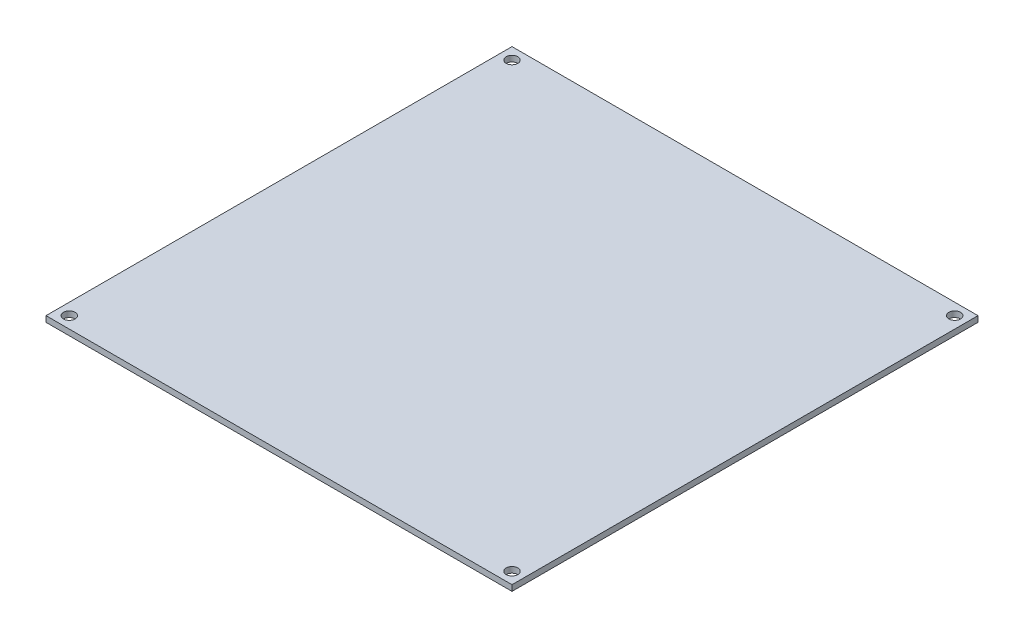
from build123d import *

# Parameters (mm, degrees)
SKETCH1_W           = 127
SKETCH1_H           = 127
SKETCH1_R           = 1.5875
BOSS_EXTRUDE1_DEPTH = 1.5875


with BuildPart() as part:
    # Sketch1 → Boss-Extrude1 (new body)
    with BuildSketch(Plane(origin=(0, 0, 0), x_dir=(1, 0, 0), z_dir=(0, 1, 0))):
        with Locations((63.5, 63.5)):
            Rectangle(SKETCH1_W, SKETCH1_H)
        with Locations(Location((3.175, 123.825, 0), (0, 0, 270))):
            Circle(SKETCH1_R, mode=Mode.SUBTRACT)
        with Locations(Location((123.825, 123.825, 0), (0, 0, 270))):
            Circle(SKETCH1_R, mode=Mode.SUBTRACT)
        with Locations(Location((123.825, 3.175, 0), (0, 0, 270))):
            Circle(SKETCH1_R, mode=Mode.SUBTRACT)
        with Locations(Location((3.175, 3.175, 0), (0, 0, 270))):
            Circle(SKETCH1_R, mode=Mode.SUBTRACT)
    extrude(amount=BOSS_EXTRUDE1_DEPTH)


solid = part.part
